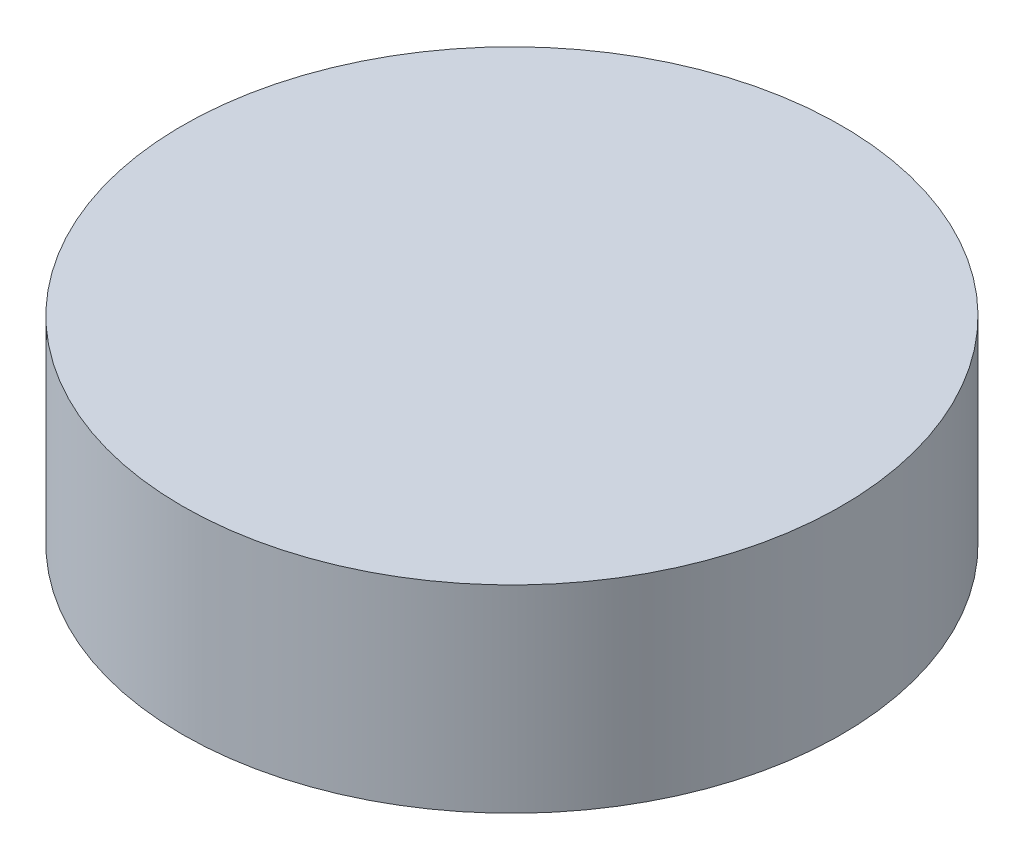
from build123d import *

# Parameters (mm, degrees)
SKETCH1_R           = 0.04
BOSS_EXTRUDE1_DEPTH = 0.024


with BuildPart() as part:
    # Sketch1 → Boss-Extrude1 (new body)
    with BuildSketch(Plane(origin=(0, 0, 0), x_dir=(1, 0, 0), z_dir=(0, 1, 0))):
        with Locations(Location((0, 0, 0), (0, 0, 270))):
            Circle(SKETCH1_R)
    extrude(amount=BOSS_EXTRUDE1_DEPTH)


solid = part.part
